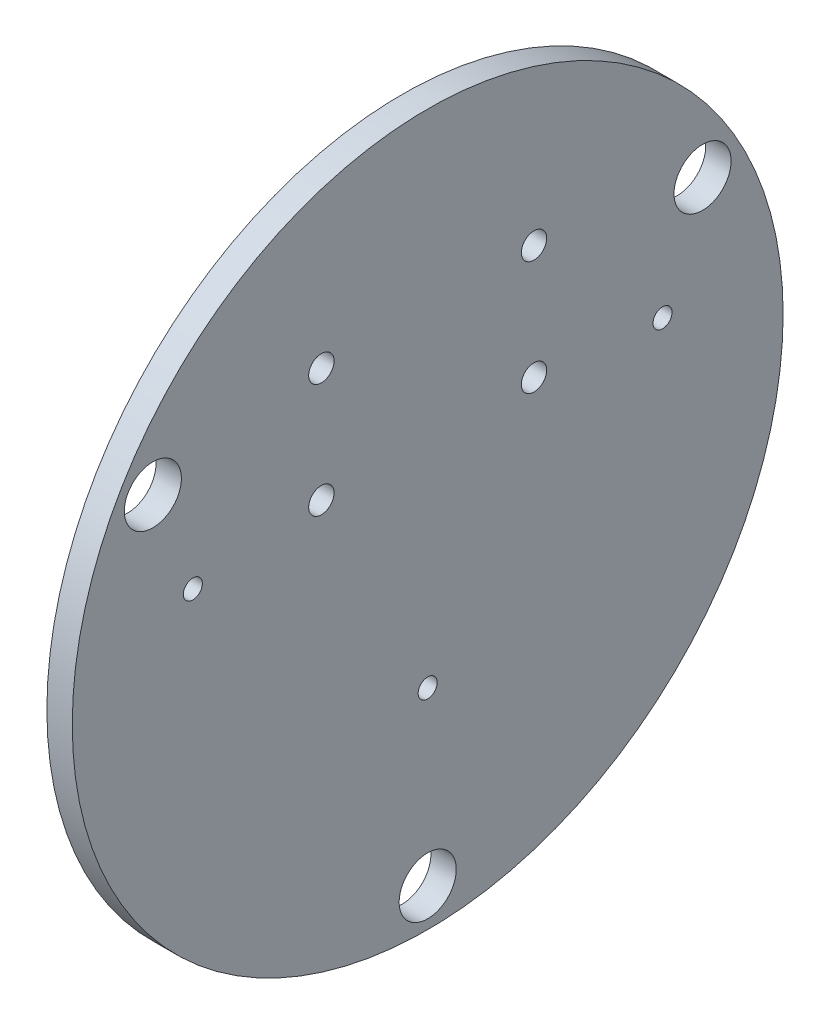
from build123d import *

# Parameters (mm, degrees)
SKETCH1_R           = 56
BOSS_EXTRUDE1_DEPTH = 4
SKETCH2_R           = 4.5
CUT_EXTRUDE1_DEPTH  = 80.296910406
SKETCH4_R           = 2
SKETCH4_R_2         = 1.5
CUT_EXTRUDE3_DEPTH  = 80.296910406


with BuildPart() as part:
    # Sketch1 → Boss-Extrude1 (new body)
    with BuildSketch(Plane(origin=(0, 0, 0), x_dir=(0, 0, -1), z_dir=(1, 0, 0))):
        Circle(SKETCH1_R)
    extrude(amount=BOSS_EXTRUDE1_DEPTH)

    # Sketch2 → Cut-Extrude1 (cut, through all)
    with BuildSketch(Plane.ZY):
        with Locations((-43.301270189, 25)):
            Circle(SKETCH2_R)
        with Locations((43.301270189, 25)):
            Circle(SKETCH2_R)
        with Locations((0, -50)):
            Circle(SKETCH2_R)
    extrude(amount=-CUT_EXTRUDE1_DEPTH, mode=Mode.SUBTRACT)

    # Sketch4 → Cut-Extrude3 (cut, through all)
    with BuildSketch(Plane(origin=(4, 0, 0), x_dir=(0, 0, -1), z_dir=(1, 0, 0))):
        with Locations((-16.75, 28.995494219)):
            Circle(SKETCH4_R)
        with Locations((16.75, 28.995494219)):
            Circle(SKETCH4_R)
        with Locations((16.75, 11)):
            Circle(SKETCH4_R)
        with Locations((-16.75, 11)):
            Circle(SKETCH4_R)
        with Locations((-37, 9)):
            Circle(SKETCH4_R_2)
        with Locations((0, -23)):
            Circle(SKETCH4_R_2)
        with Locations((37, 9)):
            Circle(SKETCH4_R_2)
    extrude(amount=-CUT_EXTRUDE3_DEPTH, mode=Mode.SUBTRACT)


solid = part.part
